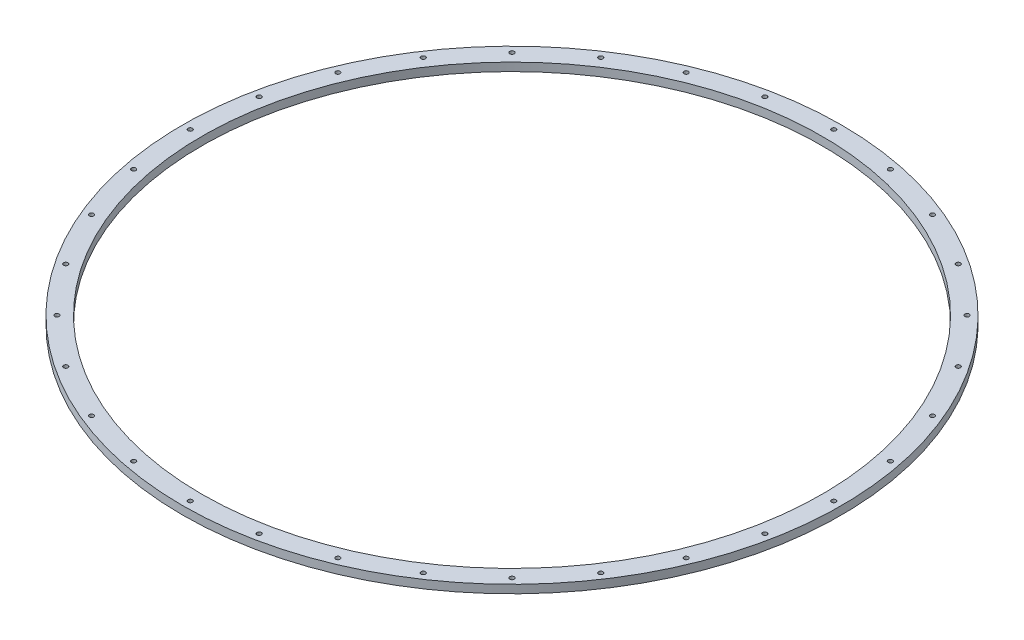
from build123d import *

# Parameters (mm, degrees)
SKETCH1_R            = 254
SKETCH1_R_2          = 239
BOSS_EXTRUDE1_DEPTH  = 3.175
M3_CLEARANCE_HOLE1_D = 3.4


with BuildPart() as part:
    # Sketch1 → Boss-Extrude1 (new, symmetric)
    with BuildSketch(Plane(origin=(0, 0, 0), x_dir=(1, 0, 0), z_dir=(0, 1, 0))):
        with Locations(Location((0, 0, 0), (0, 0, 270))):
            Circle(SKETCH1_R)
        with Locations(Location((0, 0, 0), (0, 0, 270))):
            Circle(SKETCH1_R_2, mode=Mode.SUBTRACT)
    extrude(amount=BOSS_EXTRUDE1_DEPTH, both=True)

    # M3 Clearance Hole1 (through all)
    with Locations(Plane(origin=(0, 3.175, 0), x_dir=(1, 0, 0), z_dir=(0, 1, 0))):
        with Locations((248, 0), (243.23474954, -48.38239986), (229.122124063, -94.905491227), (206.204463851, -137.781417789), (175.362481734, -175.362481734), (137.781417789, -206.204463851), (94.905491227, -229.122124063), (48.38239986, -243.23474954), (0, -248), (-48.38239986, -243.23474954), (-94.905491227, -229.122124063), (-137.781417789, -206.204463851), (-175.362481734, -175.362481734), (-206.204463851, -137.781417789), (-229.122124063, -94.905491227), (-243.23474954, -48.38239986), (-248, 0), (-243.23474954, 48.38239986), (-229.122124063, 94.905491227), (-206.204463851, 137.781417789), (-175.362481734, 175.362481734), (-137.781417789, 206.204463851), (-94.905491227, 229.122124063), (-48.38239986, 243.23474954), (0, 248), (48.38239986, 243.23474954), (94.905491227, 229.122124063), (137.781417789, 206.204463851), (175.362481734, 175.362481734), (206.204463851, 137.781417789), (229.122124063, 94.905491227), (243.23474954, 48.38239986)):
            Hole(M3_CLEARANCE_HOLE1_D / 2)


solid = part.part
